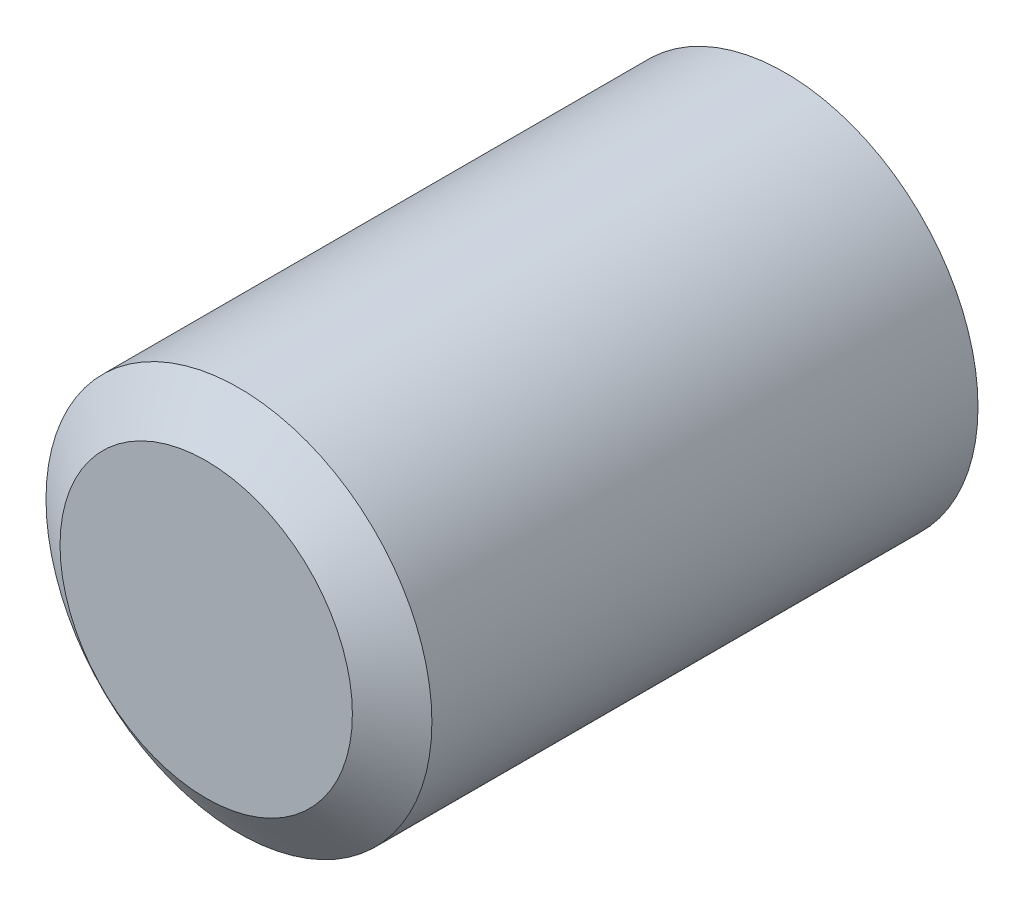
from build123d import *

# Parameters (mm, degrees)
SKETCH1_R           = 3.175
BOSS_EXTRUDE1_DEPTH = 9.525


with BuildPart() as part:
    # Sketch1 → Boss-Extrude1 (new body)
    with BuildSketch(Plane.XY):
        Circle(SKETCH1_R)
    extrude(amount=BOSS_EXTRUDE1_DEPTH)

    # Sketch2 → Cut-Revolve1 (revolve, cut)
    with BuildSketch(Plane(origin=(0, 0, 0), x_dir=(0, 0, -1), z_dir=(1, 0, 0))):
        Polygon((-9.525, 3.175), (-9.525, 2.405444262), (-8.986151271, 3.175), align=None)
    revolve(axis=Axis((0, 0, 0), (0, 0, 1)), mode=Mode.SUBTRACT)


solid = part.part
